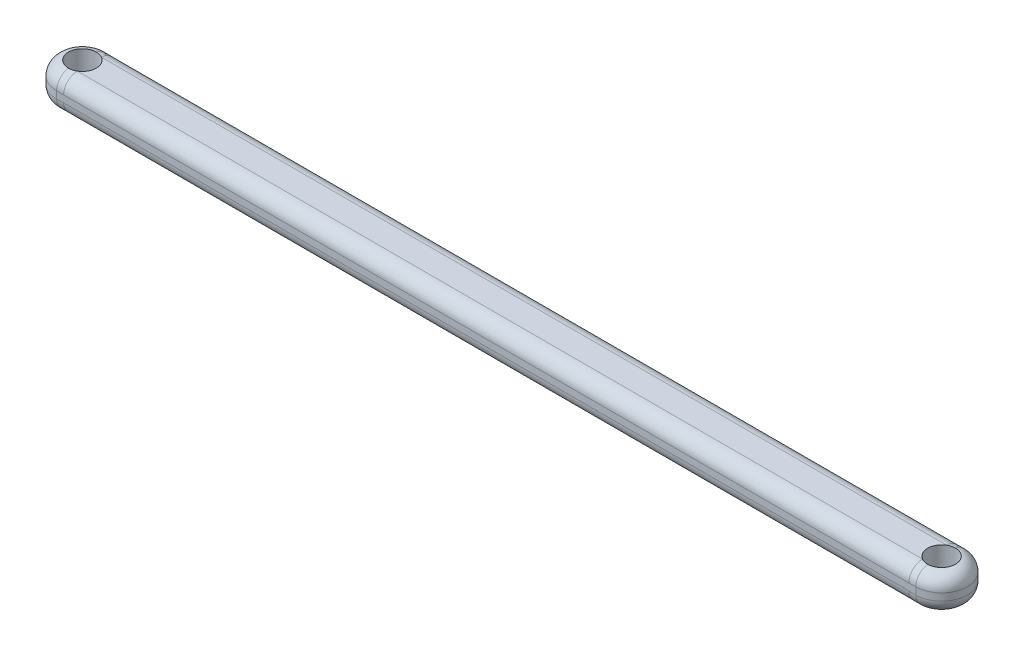
from build123d import *

# Parameters (mm, degrees)
CROQUIS1_R              = 4.05
SALIENTE_EXTRUIR1_DEPTH = 5
REDONDEO6_R             = 4


with BuildPart() as part:
    # Croquis1 → Saliente-Extruir1 (new, symmetric)
    with BuildSketch(Plane(origin=(0, 0, 0), x_dir=(-1, 0, 0), z_dir=(0, 1, 0))):
        with BuildLine():
            Line((0, -7.5), (250, -7.5))
            ThreePointArc((250, -7.5), (257.5, 0), (250, 7.5))
            Line((250, 7.5), (0, 7.5))
            ThreePointArc((0, 7.5), (-7.5, 0), (0, -7.5))
        make_face()
        with Locations(Location((0, 0, 0), (0, 0, 90))):
            Circle(CROQUIS1_R, mode=Mode.SUBTRACT)
        with Locations(Location((250, 0, 0), (0, 0, 90))):
            Circle(CROQUIS1_R, mode=Mode.SUBTRACT)
    extrude(amount=SALIENTE_EXTRUIR1_DEPTH, both=True)

    # Redondeo6
    redondeo6_edges = [part.edges().sort_by_distance(p)[0] for p in [
        (-125, 5, 7.5),
        (-125, -5, 7.5),
        (-125, 5, -7.5),
        (-125, -5, -7.5),
    ]]
    fillet(redondeo6_edges, radius=REDONDEO6_R)


solid = part.part
